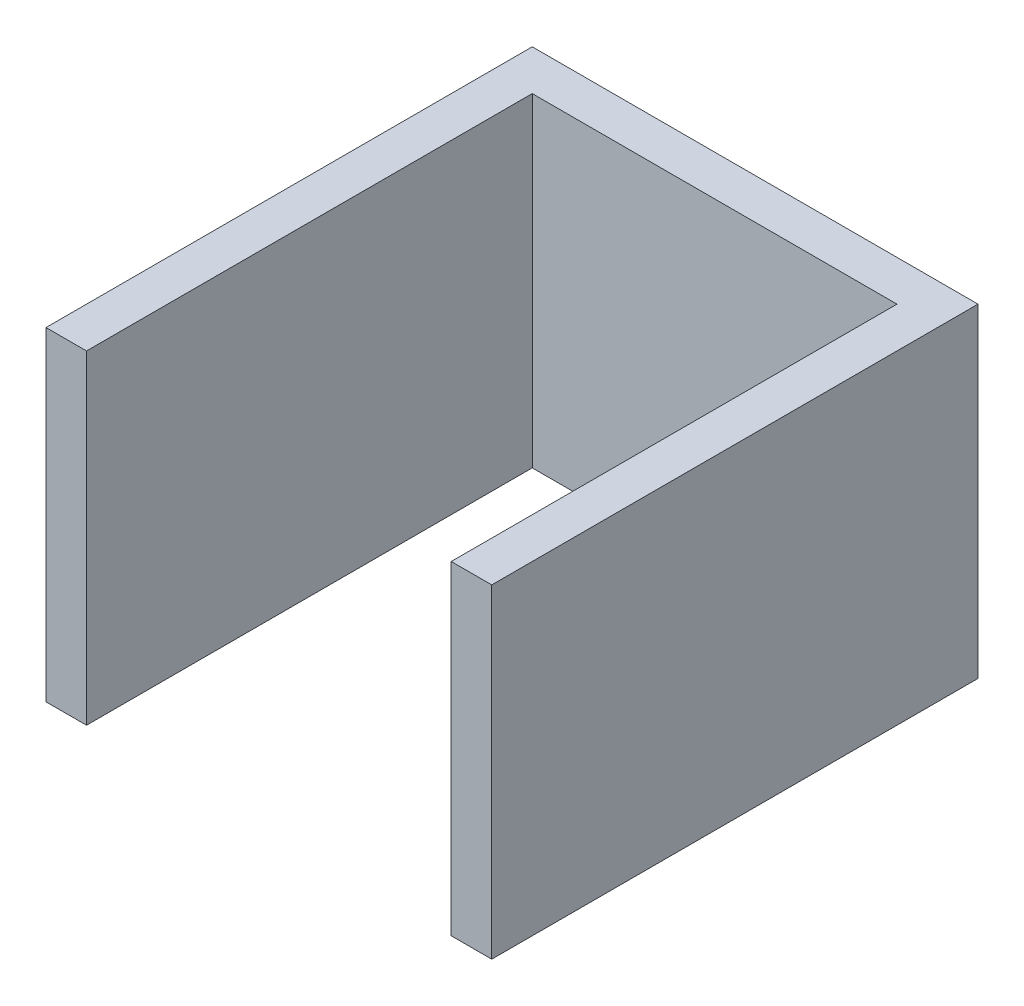
from build123d import *

# Parameters (mm, degrees)
BOSS_EXTRUDE1_DEPTH = 80


with BuildPart() as part:
    # Sketch1 → Boss-Extrude1 (new body)
    with BuildSketch(Plane(origin=(0, 0, 0), x_dir=(1, 0, 0), z_dir=(0, 1, 0))):
        Polygon((0, 0), (0, 120), (-110, 120), (-110, 0), (-100, 0), (-100, 110), (-10, 110), (-10, 0), align=None)
    extrude(amount=BOSS_EXTRUDE1_DEPTH)


solid = part.part
